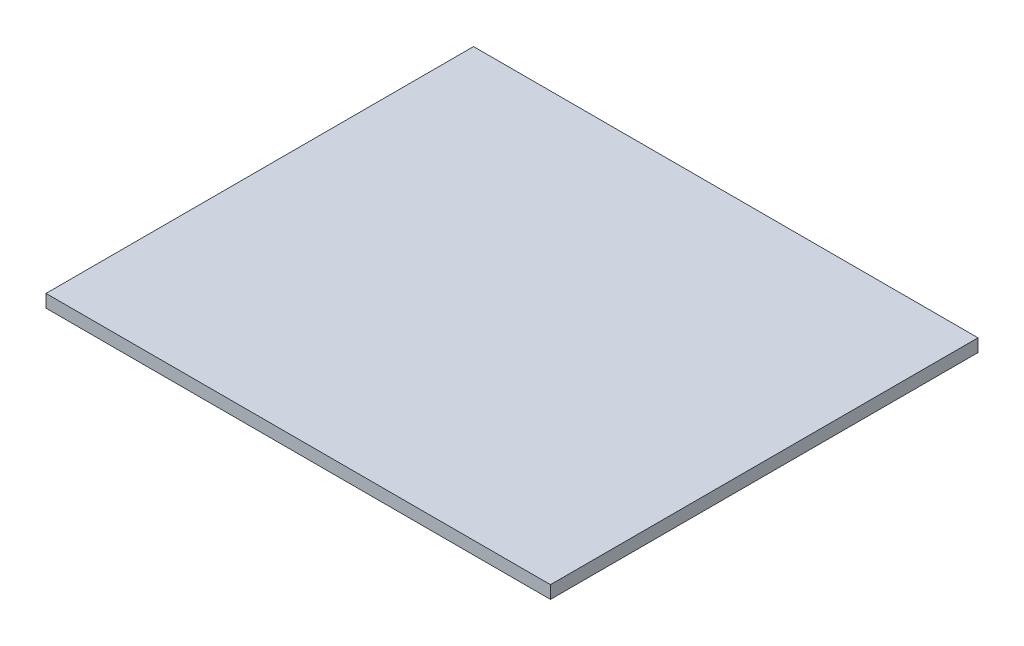
from build123d import *

# Parameters (mm, degrees)
SKETCH1_W           = 78.7
SKETCH1_H           = 66.7
BOSS_EXTRUDE1_DEPTH = 2


with BuildPart() as part:
    # Sketch1 → Boss-Extrude1 (new body)
    with BuildSketch(Plane(origin=(0, 0, 0), x_dir=(1, 0, 0), z_dir=(0, 1, 0))):
        Rectangle(SKETCH1_W, SKETCH1_H)
    extrude(amount=BOSS_EXTRUDE1_DEPTH)


solid = part.part
